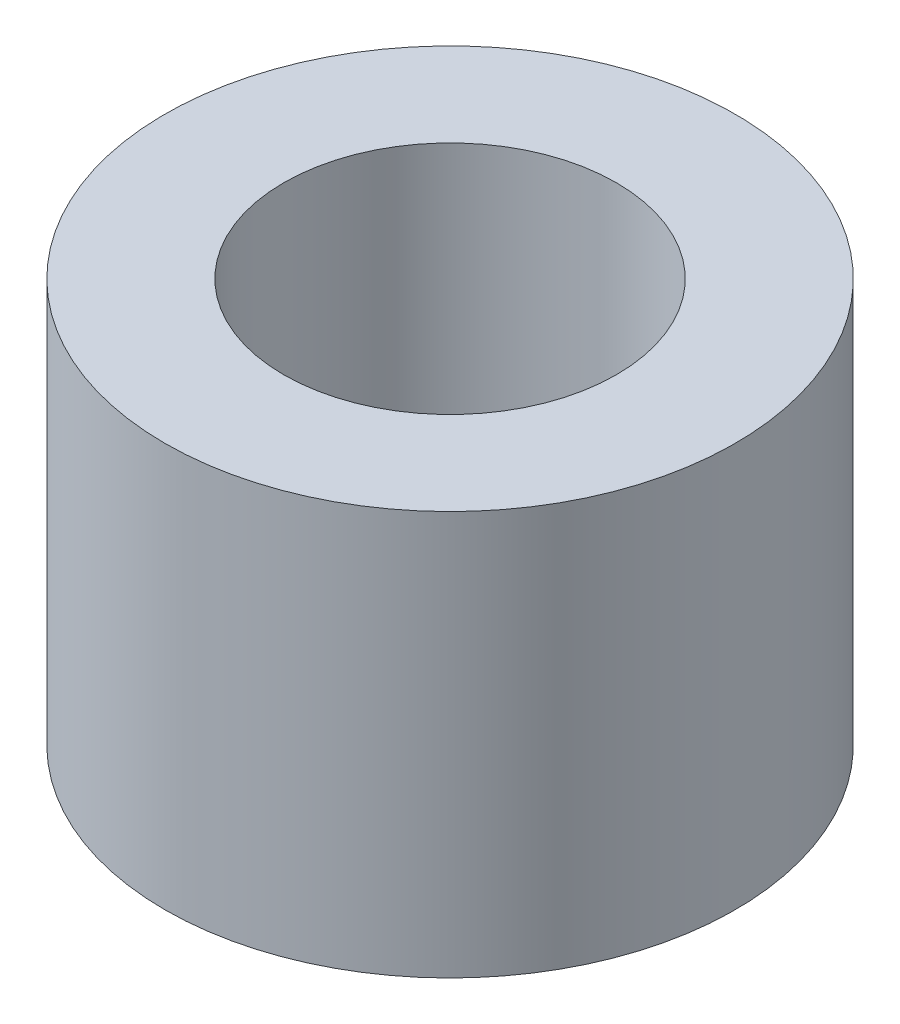
from build123d import *

# Parameters (mm, degrees)
SKETCH1_R           = 6
SKETCH1_R_2         = 3.5
BOSS_EXTRUDE1_DEPTH = 8.5


with BuildPart() as part:
    # Sketch1 → Boss-Extrude1 (new body)
    with BuildSketch(Plane(origin=(0, 0, 0), x_dir=(1, 0, 0), z_dir=(0, 1, 0))):
        with Locations(Location((0, 0, 0), (0, 0, 270))):
            Circle(SKETCH1_R)
        with Locations(Location((0, 0, 0), (0, 0, 270))):
            Circle(SKETCH1_R_2, mode=Mode.SUBTRACT)
    extrude(amount=BOSS_EXTRUDE1_DEPTH)


solid = part.part
